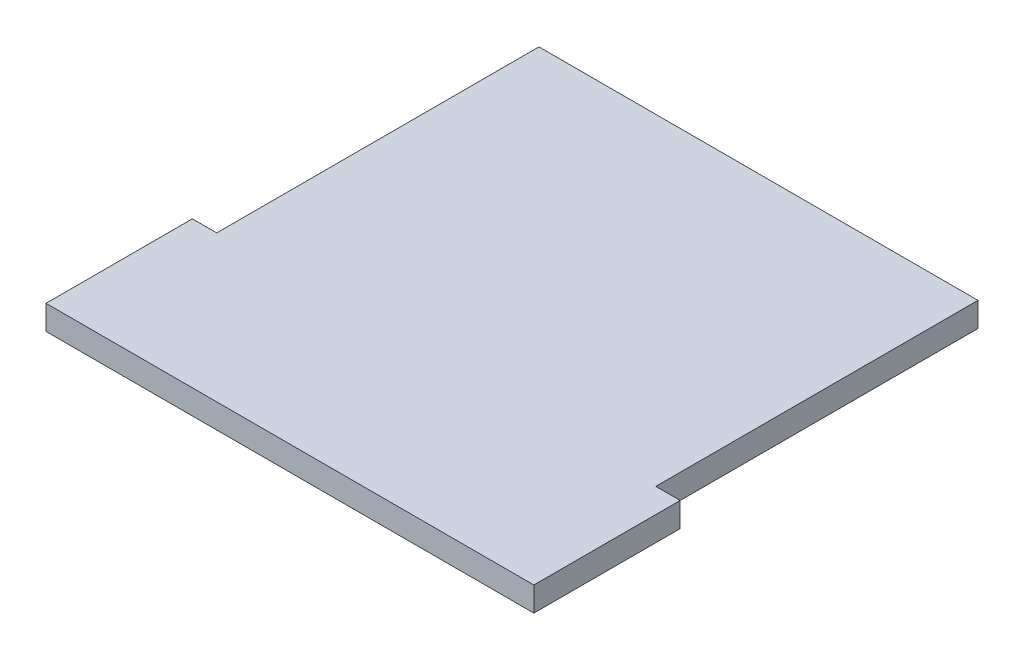
from build123d import *

# Parameters (mm, degrees)
BOSS_EXTRUDE1_DEPTH = 1.5875


with BuildPart() as part:
    # Sketch1 → Boss-Extrude1 (new body)
    with BuildSketch(Plane(origin=(0, 0, 0), x_dir=(1, 0, 0), z_dir=(0, 1, 0))):
        Polygon((15.875, 0), (-15.875, 0), (-15.875, 9.525), (-14.2875, 9.525), (-14.2875, 30.493915574), (14.2875, 30.493915574), (14.2875, 9.525), (15.875, 9.525), align=None)
    extrude(amount=BOSS_EXTRUDE1_DEPTH)


solid = part.part
